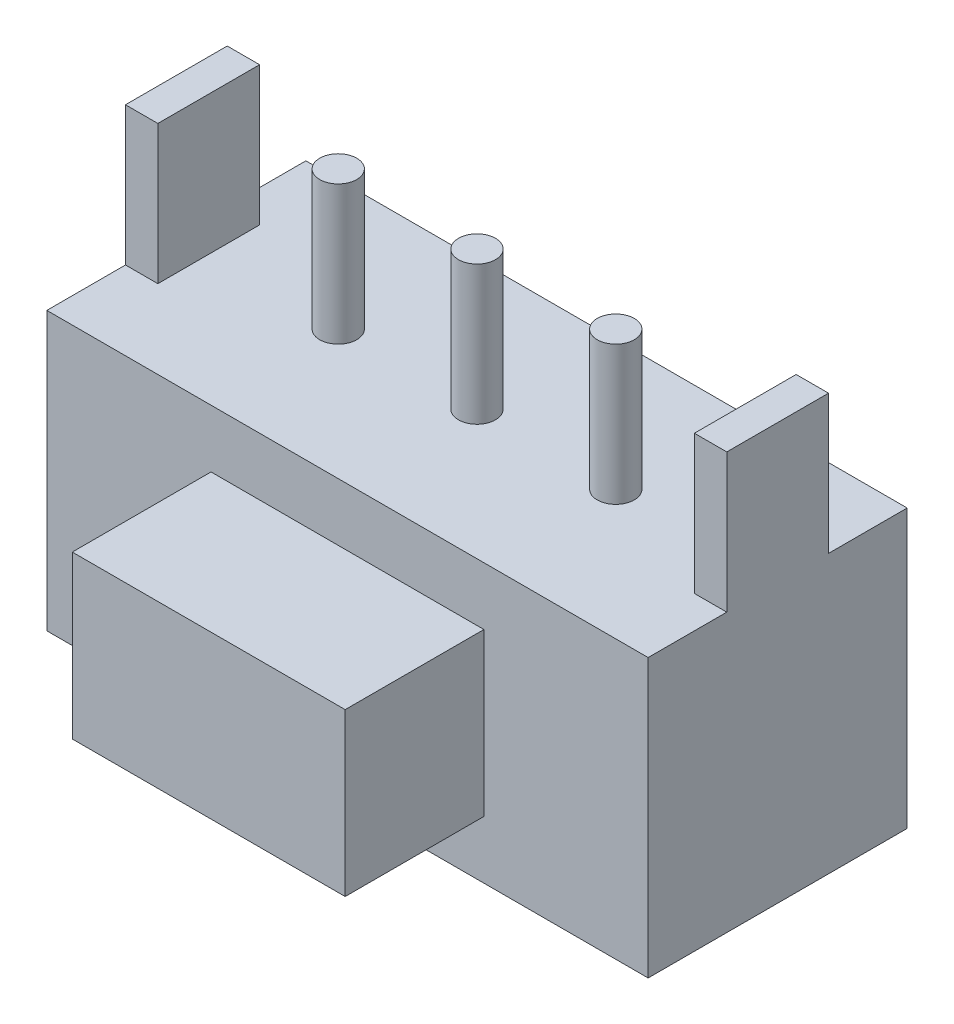
from build123d import *

# Parameters (mm, degrees)
SKETCH1_W           = 13
SKETCH1_H           = 5.6
BOSS_EXTRUDE1_DEPTH = 6
SKETCH2_R           = 0.4
SKETCH2_W           = 0.7
SKETCH2_H           = 2.2
BOSS_EXTRUDE2_DEPTH = 3
SKETCH3_W           = 5.9
SKETCH3_H           = 3.5
BOSS_EXTRUDE3_DEPTH = 3


with BuildPart() as part:
    # Sketch1 → Boss-Extrude1 (new body)
    with BuildSketch(Plane(origin=(0, 0, 0), x_dir=(1, 0, 0), z_dir=(0, 1, 0))):
        Rectangle(SKETCH1_W, SKETCH1_H)
    extrude(amount=BOSS_EXTRUDE1_DEPTH)

    # Sketch2 → Boss-Extrude2 (add)
    with BuildSketch(Plane(origin=(0, 6, 0), x_dir=(1, 0, 0), z_dir=(0, 1, 0))):
        with Locations(Location((-3, 0, 0), (0, 0, 270))):
            Circle(SKETCH2_R)
        with Locations(Location((0, 0, 0), (0, 0, 270))):
            Circle(SKETCH2_R)
        with Locations(Location((3, 0, 0), (0, 0, 270))):
            Circle(SKETCH2_R)
        with Locations((-6.15, 0)):
            Rectangle(SKETCH2_W, SKETCH2_H)
        with Locations((6.15, 0)):
            Rectangle(SKETCH2_W, SKETCH2_H)
    extrude(amount=BOSS_EXTRUDE2_DEPTH)

    # Sketch3 → Boss-Extrude3 (add)
    with BuildSketch(Plane.XY.offset(2.8)):
        with Locations((0, 3)):
            Rectangle(SKETCH3_W, SKETCH3_H)
    extrude(amount=BOSS_EXTRUDE3_DEPTH)


solid = part.part
